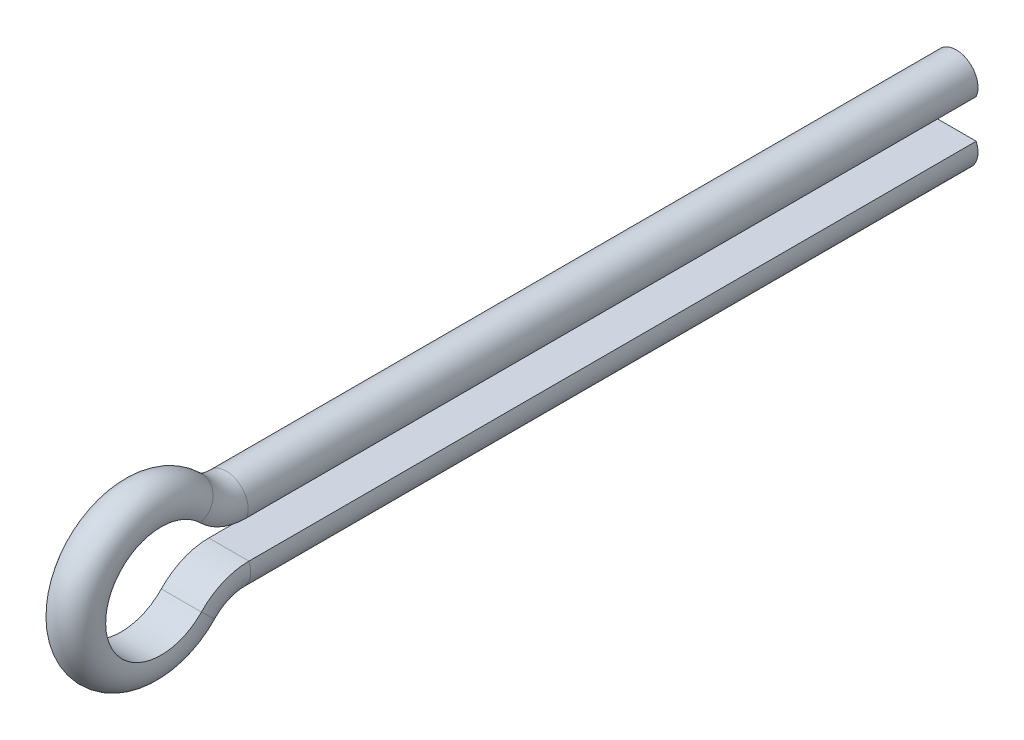
from build123d import *


with BuildPart() as part:
    # Sweep1: sweep along a path in Sketch1
    with BuildLine(Plane(origin=(0, 0, 0), x_dir=(0, 0, -1), z_dir=(1, 0, 0))) as sweep1_path:
        Line((146.769713615, 4.71426304), (-20.083211115, 4.71426304))
        ThreePointArc((-20.083211115, 4.71426304), (-25.778213065, 5.837413514), (-30.620369131, 9.038669336))
        ThreePointArc((-30.620369131, 9.038669336), (-52.240381848, -0.191756193), (-30.351519864, -8.76517012))
        ThreePointArc((-30.351519864, -8.76517012), (-25.400701432, -5.328453957), (-19.496823343, -4.117733253))
        Line((-19.496823343, -4.117733253), (146.769713615, -4.117733253))
    # Sketch2 → Sweep1 (sweep)
    with BuildSketch(Plane(origin=(0, 4.71426304, -146.769713615), x_dir=(-1, 0, 0), z_dir=(0, 0, -1))):
        with BuildLine():
            Line((-4.582575695, -0.004424014), (4.582575695, -0.004424014))
            ThreePointArc((4.582575695, -0.004424014), (0, 6.995575986), (-4.582575695, -0.004424014))
        make_face()
    sweep(path=sweep1_path.line)


solid = part.part
